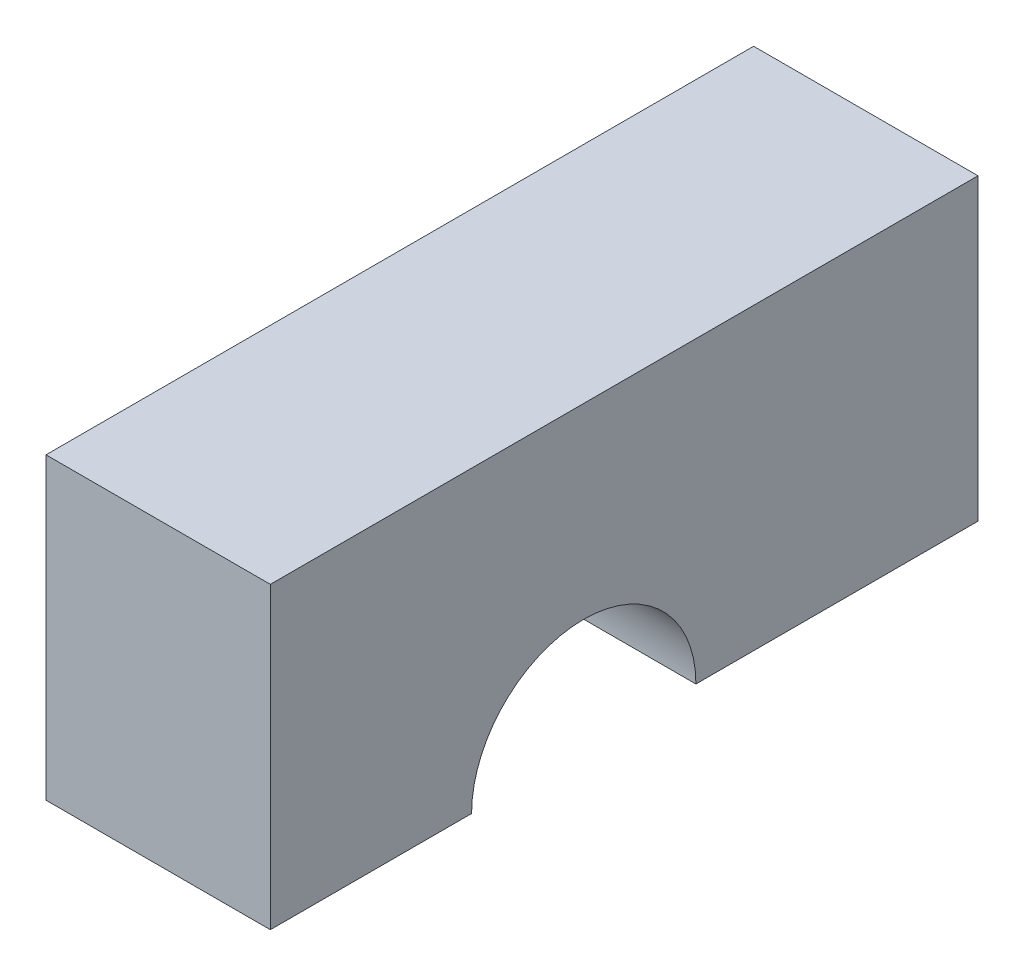
from build123d import *

# Parameters (mm, degrees)
SKETCH1_W           = 19.05
SKETCH1_H           = 60.088962611
BOSS_EXTRUDE1_DEPTH = 25.4
SKETCH2_R           = 9.525
CUT_EXTRUDE1_DEPTH  = 54.0916873


with BuildPart() as part:
    # Sketch1 → Boss-Extrude1 (new body)
    with BuildSketch(Plane(origin=(0, 0, 0), x_dir=(1, 0, 0), z_dir=(0, 1, 0))):
        with Locations((-9.525, -12.507425354)):
            Rectangle(SKETCH1_W, SKETCH1_H)
    extrude(amount=BOSS_EXTRUDE1_DEPTH)

    # Sketch2 → Cut-Extrude1 (cut, through all)
    with BuildSketch(Plane(origin=(0, 0, 0), x_dir=(0, 0, -1), z_dir=(1, 0, 0))):
        with Locations((-15.940368243, 0)):
            Circle(SKETCH2_R)
    extrude(amount=-CUT_EXTRUDE1_DEPTH, mode=Mode.SUBTRACT)


solid = part.part
